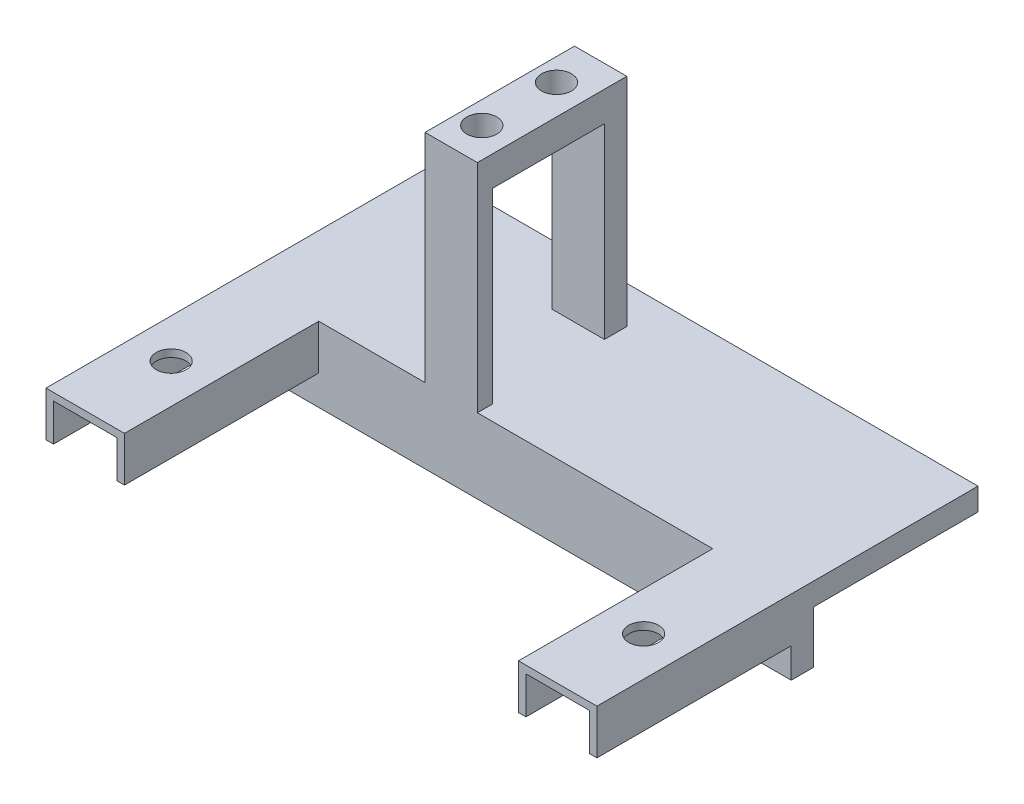
from build123d import *

# Parameters (mm, degrees)
SKETCH1_W           = 73.73
SKETCH1_H           = 10
BOSS_EXTRUDE1_DEPTH = 3
BOSS_EXTRUDE2_DEPTH = 26
BOSS_EXTRUDE3_DEPTH = 26
SKETCH8_R           = 2
CUT_EXTRUDE1_DEPTH  = 80.85682751
SKETCH10_W          = 73.73
SKETCH10_H          = 3
BOSS_EXTRUDE4_DEPTH = 22
SKETCH11_W          = 7
SKETCH11_H          = 20
BOSS_EXTRUDE5_DEPTH = 29
SKETCH12_R          = 2
CUT_EXTRUDE2_DEPTH  = 10
SKETCH13_W          = 15
SKETCH13_H          = 25
CUT_EXTRUDE3_DEPTH  = 70.014491232


with BuildPart() as part:
    # Sketch1 → Boss-Extrude1 (new body)
    with BuildSketch(Plane.XY):
        with Locations((36.865, 5)):
            Rectangle(SKETCH1_W, SKETCH1_H)
    extrude(amount=BOSS_EXTRUDE1_DEPTH)

    # Sketch2 → Boss-Extrude2 (add)
    with BuildSketch(Plane.XY.offset(3)):
        Polygon((0, 4), (0, 10), (10.5, 10), (10.5, 4), (9.5, 4), (9.5, 9), (1, 9), (1, 4), align=None)
    extrude(amount=BOSS_EXTRUDE2_DEPTH)

    # Sketch7 → Boss-Extrude3 (add)
    with BuildSketch(Plane.XY.offset(3)):
        Polygon((73.73, 10), (73.73, 4), (72.73, 4), (72.73, 9), (64.23, 9), (64.23, 4), (63.23, 4), (63.23, 10), align=None)
    extrude(amount=BOSS_EXTRUDE3_DEPTH)

    # Sketch8 → Cut-Extrude1 (cut, through all)
    with BuildSketch(Plane(origin=(0, 10, 0), x_dir=(1, 0, 0), z_dir=(0, 1, 0))):
        with Locations(Location((5.25, -17.5, 0), (0, 0, 270))):
            Circle(SKETCH8_R)
        with Locations(Location((68.48, -17.5, 0), (0, 0, 270))):
            Circle(SKETCH8_R)
    extrude(amount=-CUT_EXTRUDE1_DEPTH, mode=Mode.SUBTRACT)

    # Sketch10 → Boss-Extrude4 (add)
    with BuildSketch(Plane(origin=(0, 0, 0), x_dir=(-1, 0, 0), z_dir=(0, 0, -1))):
        with Locations((-36.865, 8.5)):
            Rectangle(SKETCH10_W, SKETCH10_H)
    extrude(amount=BOSS_EXTRUDE4_DEPTH)

    # Sketch11 → Boss-Extrude5 (add)
    with BuildSketch(Plane(origin=(0, 10, 0), x_dir=(1, 0, 0), z_dir=(0, 1, 0))):
        with Locations((28.23, 7)):
            Rectangle(SKETCH11_W, SKETCH11_H)
    extrude(amount=BOSS_EXTRUDE5_DEPTH)

    # Sketch12 → Cut-Extrude2 (cut)
    with BuildSketch(Plane(origin=(0, 39, 0), x_dir=(1, 0, 0), z_dir=(0, 1, 0))):
        with Locations(Location((27.73, 11.59, 0), (0, 0, 270))):
            Circle(SKETCH12_R)
        with Locations(Location((27.73, 1.59, 0), (0, 0, 270))):
            Circle(SKETCH12_R)
    extrude(amount=-CUT_EXTRUDE2_DEPTH, mode=Mode.SUBTRACT)

    # Sketch13 → Cut-Extrude3 (cut, through all)
    with BuildSketch(Plane.ZY.offset(-24.73)):
        with Locations((-6.5, 22.5)):
            Rectangle(SKETCH13_W, SKETCH13_H)
    extrude(amount=-CUT_EXTRUDE3_DEPTH, mode=Mode.SUBTRACT)


solid = part.part
